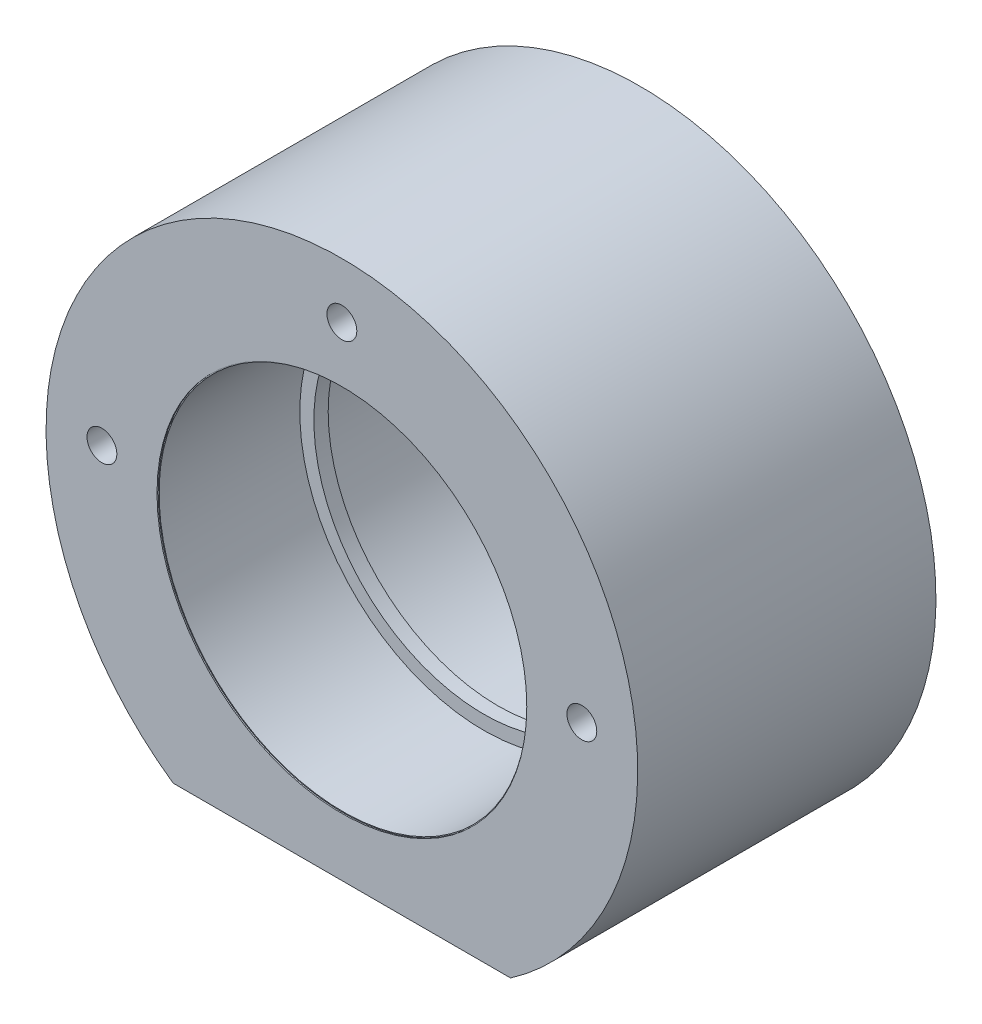
from build123d import *

# Parameters (mm, degrees)
SKETCH1_R           = 16.5
BOSS_EXTRUDE1_DEPTH = 50
SKETCH2_R           = 17.5
CUT_EXTRUDE1_DEPTH  = 11
SKETCH3_R           = 2
CUT_EXTRUDE2_DEPTH  = 10
SCALE1_SCALE        = 1.771428571
BOSS_EXTRUDE2_START = -49.599999988
SKETCH4_R           = 29.228571421
SKETCH4_R_2         = 28.498571422
BOSS_EXTRUDE2_DEPTH = 49.599999988
CUT_EXTRUDE6_START  = -44.285714
SKETCH6_R           = 28.498571422
CUT_EXTRUDE6_DEPTH  = 19.285
CUT_EXTRUDE7_START  = 50.000714
SKETCH7_R           = 28.498571422
CUT_EXTRUDE7_DEPTH  = 19.285
SKETCH9_R           = 30.85
CUT_EXTRUDE8_DEPTH  = 23.8
SKETCH10_R          = 2.5
CUT_EXTRUDE9_DEPTH  = 50.00142855


with BuildPart() as part:
    # Sketch1 → Boss-Extrude1 (new body)
    with BuildSketch(Plane.XY):
        with BuildLine():
            Line((-15.968719423, 0), (15.968719423, 0))
            ThreePointArc((15.968719423, 0), (0, 51), (-15.968719423, 0))
        make_face()
        with Locations((0, 23)):
            Circle(SKETCH1_R, mode=Mode.SUBTRACT)
    extrude(amount=BOSS_EXTRUDE1_DEPTH)

    # Sketch2 → Cut-Extrude1 (cut)
    with BuildSketch(Plane.XY.offset(50)):
        with Locations((0, 23)):
            Circle(SKETCH2_R)
    cut_extrude1 = extrude(amount=-CUT_EXTRUDE1_DEPTH, mode=Mode.SUBTRACT)

    # Mirror1: Cut-Extrude1 across plane
    add(cut_extrude1.mirror(Plane.XY.offset(25)), mode=Mode.SUBTRACT)

    # Sketch3 → Cut-Extrude2 (cut)
    with BuildSketch(Plane(origin=(0, 0, 0), x_dir=(-1, 0, 0), z_dir=(0, 0, -1))):
        with Locations((0, 45.5)):
            Circle(SKETCH3_R)
        with Locations((-22.5, 23)):
            Circle(SKETCH3_R)
        with Locations((22.5, 23)):
            Circle(SKETCH3_R)
    cut_extrude2 = extrude(amount=-CUT_EXTRUDE2_DEPTH, mode=Mode.SUBTRACT)

    # Mirror2: Cut-Extrude2 across plane
    add(cut_extrude2.mirror(Plane.XY.offset(25)), mode=Mode.SUBTRACT)


with BuildPart() as part_1:
    # Scale1: scaled about (0, 24.810283146, 25)
    add(part.part.scale(SCALE1_SCALE).moved(Location((0, -19.139361273, -19.285714275))))

    # Sketch4 → Boss-Extrude2 (add)
    with BuildSketch(Plane.XY.offset(49.799999994).offset(BOSS_EXTRUDE2_START)):
        with Locations((0, 21.60349586)):
            Circle(SKETCH4_R)
        with Locations((0, 21.60349586)):
            Circle(SKETCH4_R_2, mode=Mode.SUBTRACT)
    extrude(amount=BOSS_EXTRUDE2_DEPTH)

    # Sketch6 → Cut-Extrude6 (cut)
    with BuildSketch(Plane.XY.offset(25).offset(CUT_EXTRUDE6_START)):
        with BuildLine():
            Line((-28.287445828, -19.139361273), (28.287445828, -19.139361273))
            ThreePointArc((28.287445828, -19.139361273), (0, 71.203495848), (-28.287445828, -19.139361273))
        make_face()
        with Locations((0, 21.60349586)):
            Circle(SKETCH6_R, mode=Mode.SUBTRACT)
    extrude(amount=CUT_EXTRUDE6_DEPTH, mode=Mode.SUBTRACT)

    # Sketch7 → Cut-Extrude7 (cut)
    with BuildSketch(Plane.XY.offset(CUT_EXTRUDE7_START)):
        with BuildLine():
            Line((-28.287445828, -19.139361273), (28.287445828, -19.139361273))
            ThreePointArc((28.287445828, -19.139361273), (0, 71.203495848), (-28.287445828, -19.139361273))
        make_face()
        with Locations((0, 21.60349586)):
            Circle(SKETCH7_R, mode=Mode.SUBTRACT)
    extrude(amount=CUT_EXTRUDE7_DEPTH, mode=Mode.SUBTRACT)

    # Sketch9 → Cut-Extrude8 (cut)
    with BuildSketch(Plane.XY.offset(50.000714275)):
        with Locations((0, 21.60349586)):
            Circle(SKETCH9_R)
    cut_extrude8 = extrude(amount=-CUT_EXTRUDE8_DEPTH, mode=Mode.SUBTRACT)

    # Mirror3: Cut-Extrude8 across plane
    add(cut_extrude8.mirror(Plane.XY.offset(25)), mode=Mode.SUBTRACT)

    # Sketch10 → Cut-Extrude9 (cut)
    with BuildSketch(Plane.XY.offset(50.000714275)):
        with Locations((0, 61.90349586)):
            Circle(SKETCH10_R)
        with Locations((-40.233402491, 23.919381004)):
            Circle(SKETCH10_R)
        with Locations((40.233400771, 23.919410876)):
            Circle(SKETCH10_R)
    extrude(amount=-CUT_EXTRUDE9_DEPTH, mode=Mode.SUBTRACT)


solid = part_1.part
